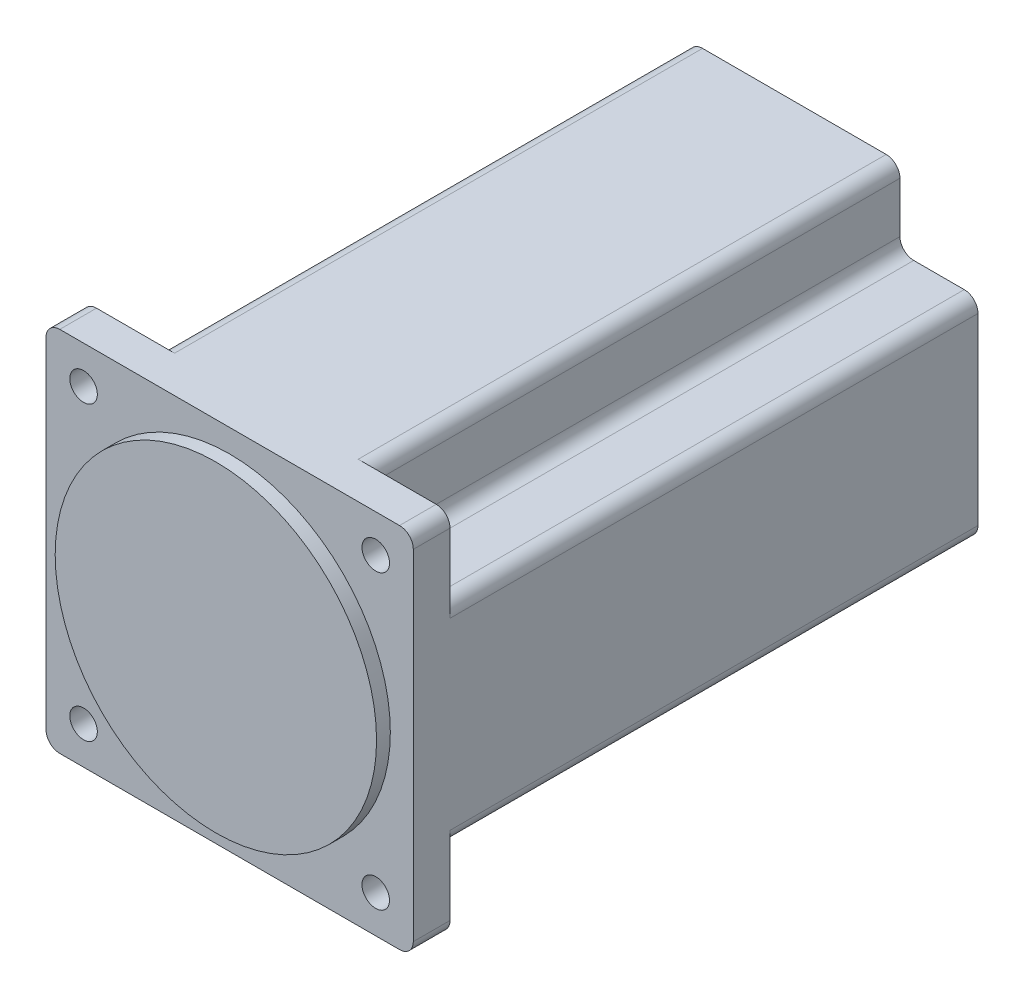
from build123d import *

# Parameters (mm, degrees)
SKETCH1_W           = 80
SKETCH1_H           = 80
SKETCH1_R           = 3
BOSS_EXTRUDE1_DEPTH = 123
SKETCH2_R           = 35
BOSS_EXTRUDE2_DEPTH = 3
SKETCH4_W           = 17
SKETCH4_H           = 17
CUT_EXTRUDE1_DEPTH  = 115
FILLET1_R           = 3


with BuildPart() as part:
    # Sketch1 → Boss-Extrude1 (new body)
    with BuildSketch(Plane.XY):
        Rectangle(SKETCH1_W, SKETCH1_H)
        with Locations((-31.819805153, 31.819805153)):
            Circle(SKETCH1_R, mode=Mode.SUBTRACT)
        with Locations((31.819805153, 31.819805153)):
            Circle(SKETCH1_R, mode=Mode.SUBTRACT)
        with Locations((31.819805153, -31.819805153)):
            Circle(SKETCH1_R, mode=Mode.SUBTRACT)
        with Locations((-31.819805153, -31.819805153)):
            Circle(SKETCH1_R, mode=Mode.SUBTRACT)
    extrude(amount=BOSS_EXTRUDE1_DEPTH)

    # Sketch2 → Boss-Extrude2 (add)
    with BuildSketch(Plane.XY.offset(123)):
        Circle(SKETCH2_R)
    extrude(amount=BOSS_EXTRUDE2_DEPTH)

    # Sketch4 → Cut-Extrude1 (cut)
    with BuildSketch(Plane(origin=(0, 0, 0), x_dir=(-1, 0, 0), z_dir=(0, 0, -1))):
        with Locations((31.5, 31.5)):
            Rectangle(SKETCH4_W, SKETCH4_H)
        with Locations((-31.5, 31.5)):
            Rectangle(SKETCH4_W, SKETCH4_H)
        with Locations((31.5, -31.5)):
            Rectangle(SKETCH4_W, SKETCH4_H)
        with Locations((-31.5, -31.5)):
            Rectangle(SKETCH4_W, SKETCH4_H)
    extrude(amount=-CUT_EXTRUDE1_DEPTH, mode=Mode.SUBTRACT)

    # Fillet1
    fillet1_edges = [part.edges().sort_by_distance(p)[0] for p in [
        (40, -23, 57.5),
        (23, -23, 57.5),
        (23, -40, 57.5),
        (-23, -40, 57.5),
        (-23, -23, 57.5),
        (-40, -23, 57.5),
        (-40, 23, 57.5),
        (-23, 23, 57.5),
        (-23, 40, 57.5),
        (40, 23, 57.5),
        (23, 40, 57.5),
        (23, 23, 57.5),
        (40, -40, 119),
        (-40, -40, 119),
        (-40, 40, 119),
        (40, 40, 119),
    ]]
    fillet(fillet1_edges, radius=FILLET1_R)


solid = part.part
